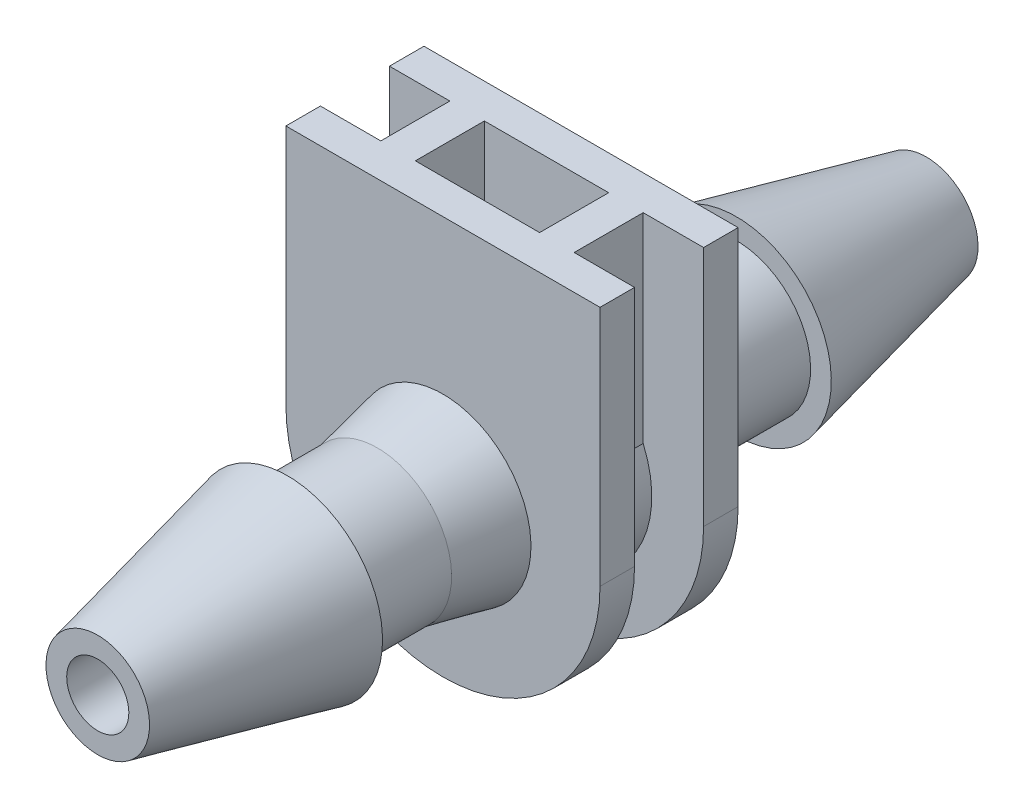
from build123d import *

# Parameters (mm, degrees)
SKETCH2_W           = 3.6
SKETCH2_H           = 2
BOSS_EXTRUDE1_DEPTH = 7


with BuildPart() as part:
    # Sketch1 → Revolve1 (revolve)
    with BuildSketch(Plane(origin=(0, 0, 0), x_dir=(0, 0, -1), z_dir=(1, 0, 0)), mode=Mode.PRIVATE) as revolve1_sk:
        Polygon((6.5, 2.75), (12, 1.5), (12, 0.9), (-12, 0.9), (-12, 1.5), (-6.5, 2.75), (-6.5, 2.15), (-3.9, 2.15), (-2, 2.55), (-2, 4.55), (-1, 4.55), (-1, 3.05), (1, 3.05), (1, 4.55), (2, 4.55), (2, 2.55), (3.9, 2.15), (6.5, 2.15), align=None)
    revolve(revolve1_sk.sketch.rotate(Axis((0, 0, 12), (0, 0, -1)), 180), axis=Axis((0, 0, 12), (0, 0, -1)))

    # Sketch2 → Boss-Extrude1 (add)
    with BuildSketch(Plane(origin=(0, 0, 0), x_dir=(1, 0, 0), z_dir=(0, 1, 0))):
        Polygon((-4.55, 2), (-4.55, 1), (-2.8, 1), (-2.8, -1), (-4.55, -1), (-4.55, -2), (4.55, -2), (4.55, -1), (2.8, -1), (2.8, 1), (4.55, 1), (4.55, 2), align=None)
        Rectangle(SKETCH2_W, SKETCH2_H, mode=Mode.SUBTRACT)
    extrude(amount=BOSS_EXTRUDE1_DEPTH)


solid = part.part
